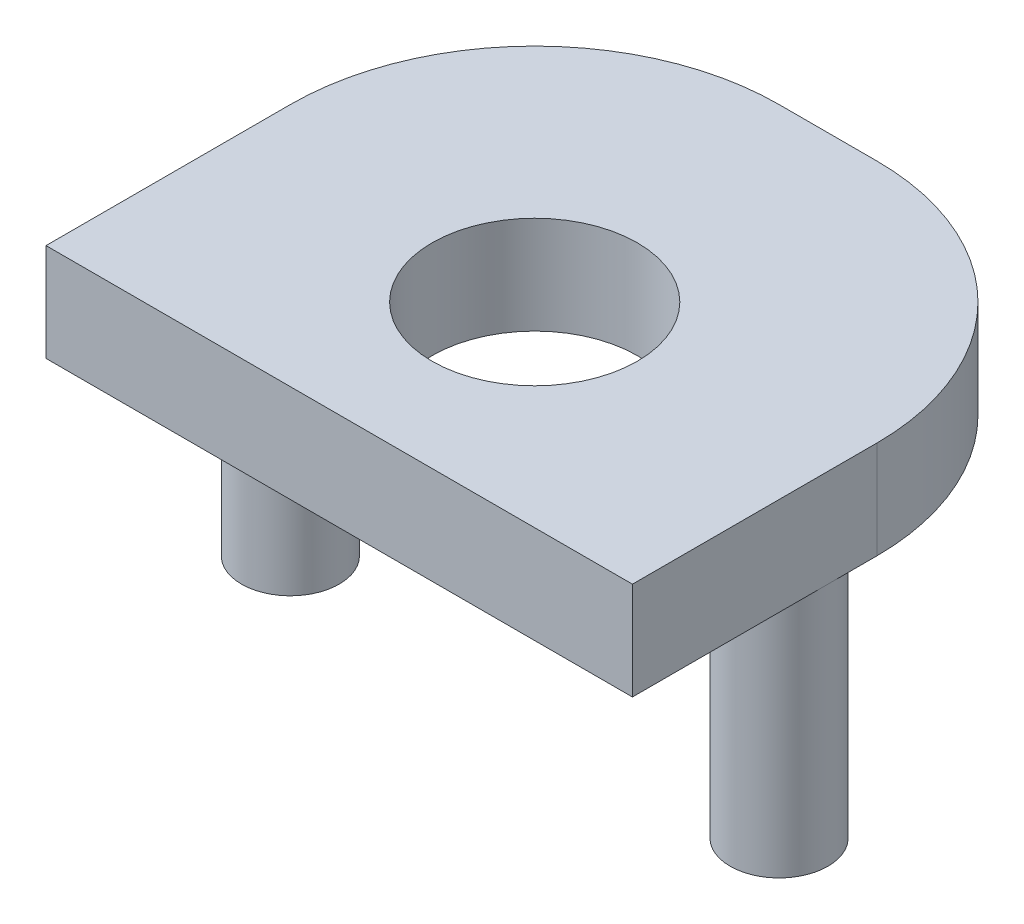
from build123d import *

# Parameters (mm, degrees)
SKETCH_1_R          = 1
EXTRUDE_1_DEPTH     = 5
EXTRUDE_1_2_DEPTH   = 5
EXTRUDE_1_3_DEPTH   = 5
SKETCH_2_W          = 12
SKETCH_2_H          = 10
EXTRUDE_6_DEPTH     = 2
SKETCH_1_6_R        = 2.1
CUT_EXTRUDE_2_DEPTH = 7
FILLET_1_R          = 5


with BuildPart() as part:
    # 草图1 → 凸台-拉伸1 (new body)
    with BuildSketch(Plane(origin=(0, 0, 0), x_dir=(1, 0, 0), z_dir=(0, 1, 0))):
        with Locations(Location((-5, 0, 0), (0, 0, 270))):
            Circle(SKETCH_1_R)
    extrude(amount=EXTRUDE_1_DEPTH)



with BuildPart() as body_2:
    # 草图1 → Extrude 1 2 (new body)
    with BuildSketch(Plane(origin=(0, 0, 0), x_dir=(1, 0, 0), z_dir=(0, 1, 0))):
        with Locations(Location((0, 5, 0), (0, 0, 270))):
            Circle(SKETCH_1_R)
    extrude(amount=EXTRUDE_1_2_DEPTH)


with BuildPart() as body_3:
    # 草图1 → Extrude 1 3 (new body)
    with BuildSketch(Plane(origin=(0, 0, 0), x_dir=(1, 0, 0), z_dir=(0, 1, 0))):
        with Locations(Location((5, 0, 0), (0, 0, 270))):
            Circle(SKETCH_1_R)
    extrude(amount=EXTRUDE_1_3_DEPTH)


with BuildPart() as part_1:
    add(part.part)

    add(body_2.part)  # 凸台-拉伸6 merges body 2

    add(body_3.part)  # 凸台-拉伸6 merges body 3
    # 草图2 → 凸台-拉伸6 (add)
    with BuildSketch(Plane(origin=(0, 5, 0), x_dir=(1, 0, 0), z_dir=(0, 1, 0))):
        with Locations((0, 1)):
            Rectangle(SKETCH_2_W, SKETCH_2_H)
    extrude(amount=EXTRUDE_6_DEPTH)

    # 草图1<6> → 切除-拉伸2 (cut)
    with BuildSketch(Plane(origin=(0, 0, 0), x_dir=(1, 0, 0), z_dir=(0, 1, 0))):
        with Locations(Location((0, 0, 0), (0, 0, 90))):
            Circle(SKETCH_1_6_R)
    extrude(amount=CUT_EXTRUDE_2_DEPTH, mode=Mode.SUBTRACT)

    # 圆角1
    fillet_1_edges = [part_1.edges().sort_by_distance(p)[0] for p in [
        (-6, 6, -6),
        (6, 6, -6),
    ]]
    fillet(fillet_1_edges, radius=FILLET_1_R)


solid = part_1.part
